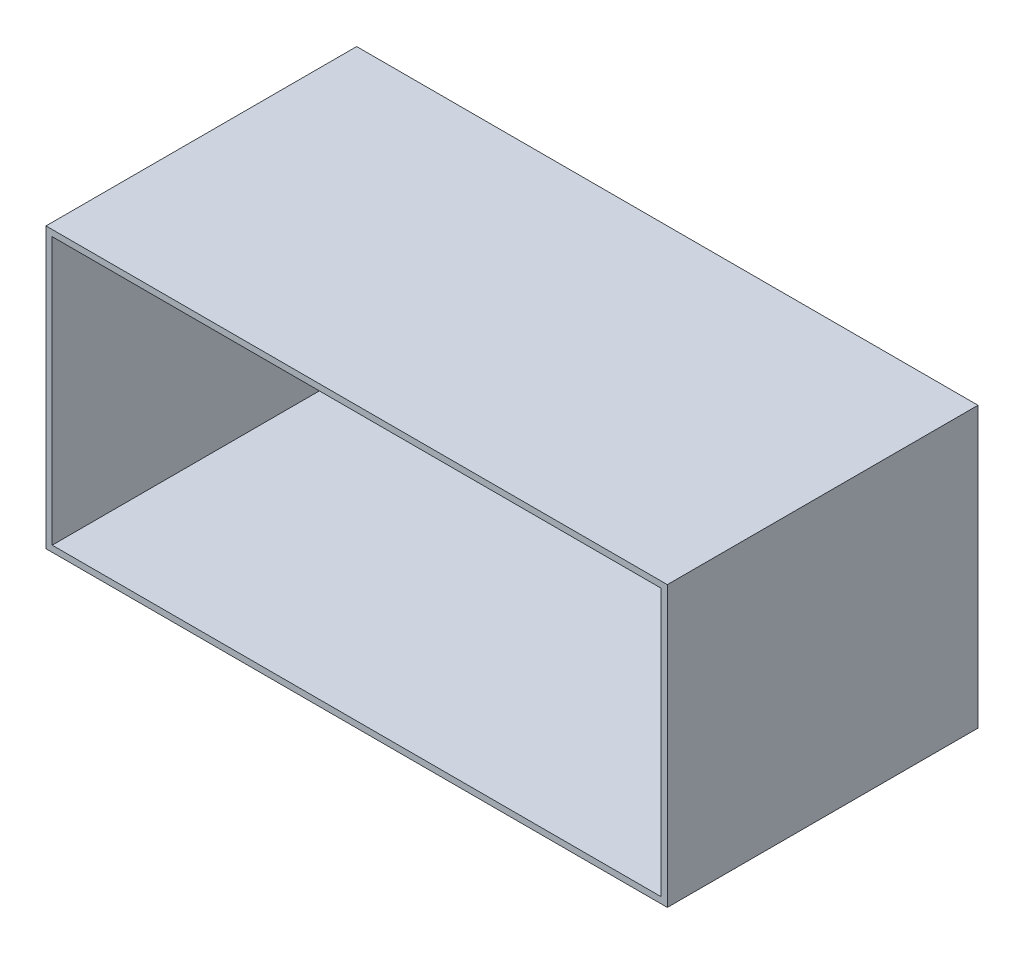
from build123d import *

# Parameters (mm, degrees)
SKETCH1_W           = 200
SKETCH1_H           = 90
SKETCH1_W_2         = 196
SKETCH1_H_2         = 86
BOSS_EXTRUDE1_DEPTH = 100


with BuildPart() as part:
    # Sketch1 → Boss-Extrude1 (new body)
    with BuildSketch(Plane.XY):
        with Locations((100, -45)):
            Rectangle(SKETCH1_W, SKETCH1_H)
        with Locations((100, -45)):
            Rectangle(SKETCH1_W_2, SKETCH1_H_2, mode=Mode.SUBTRACT)
    extrude(amount=BOSS_EXTRUDE1_DEPTH)


solid = part.part
